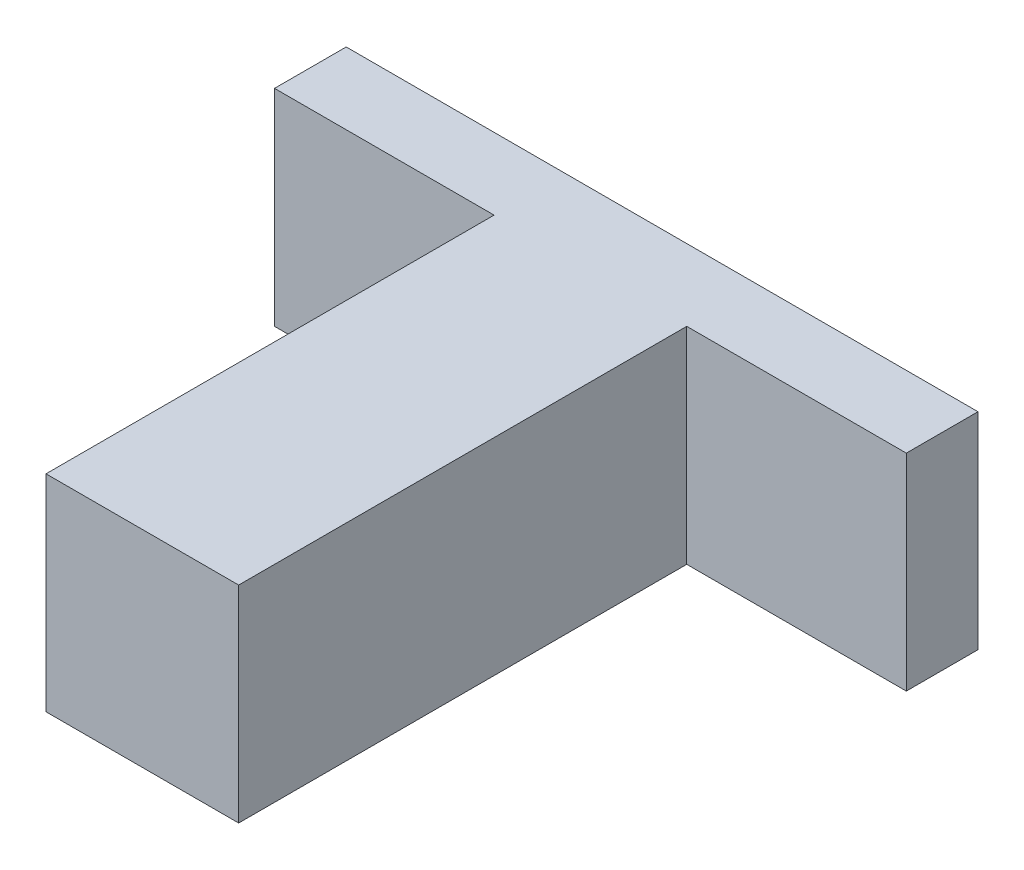
from build123d import *

# Parameters (mm, degrees)
BOSS_EXTRUDE1_DEPTH = 4.6


with BuildPart() as part:
    # Sketch1 → Boss-Extrude1 (new body)
    with BuildSketch(Plane(origin=(0, 0, 0), x_dir=(1, 0, 0), z_dir=(0, 1, 0))):
        Polygon((0, 0), (14.1, 0), (14.1, -1.6), (9.2, -1.6), (9.2, -11.6), (4.9, -11.6), (4.9, -1.6), (0, -1.6), align=None)
    extrude(amount=BOSS_EXTRUDE1_DEPTH)


solid = part.part
